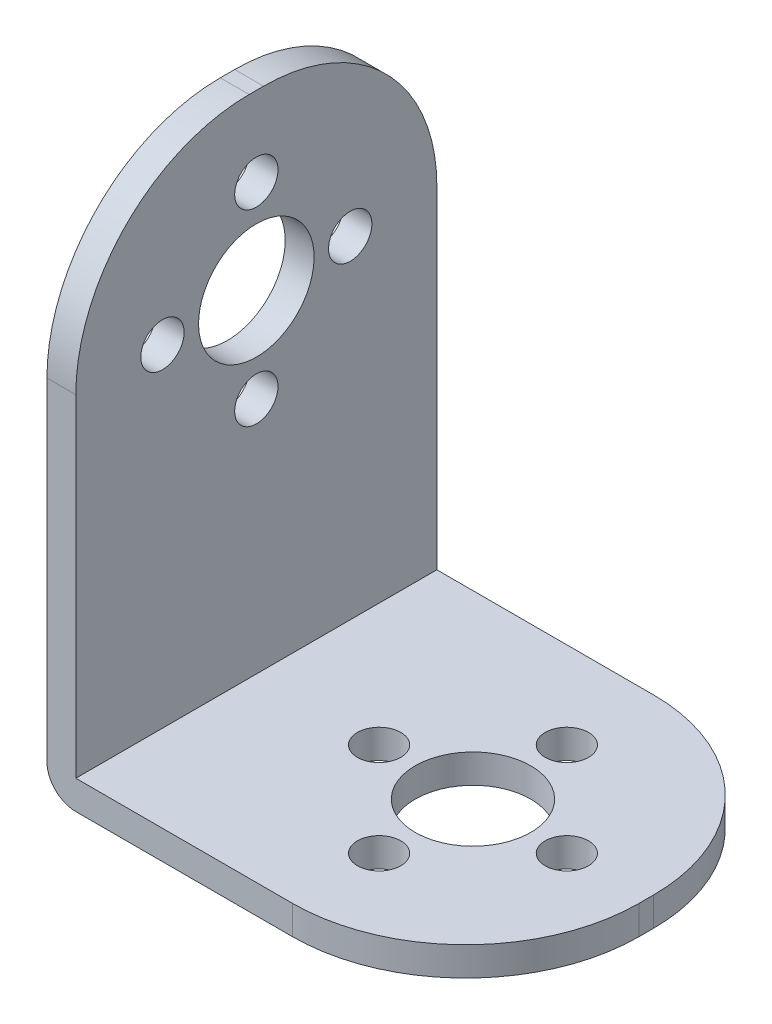
from build123d import *

# Parameters (mm, degrees)
SKETCH1_W           = 29
SKETCH1_H           = 25
BOSS_EXTRUDE1_DEPTH = 37
SKETCH2_W           = 27
SKETCH2_H           = 35
CUT_EXTRUDE1_DEPTH  = 37
FILLET1_R           = 2
SKETCH3_R           = 1.5
SKETCH3_R_2         = 4
CUT_EXTRUDE2_DEPTH  = 52.874849397
FILLET3_R           = 12
FILLET4_R           = 12
SKETCH5_R           = 1.5
SKETCH5_R_2         = 4
CUT_EXTRUDE3_DEPTH  = 53.182372503


with BuildPart() as part:
    # Sketch1 → Boss-Extrude1 (new body)
    with BuildSketch(Plane(origin=(0, 0, 0), x_dir=(1, 0, 0), z_dir=(0, 1, 0))):
        with Locations((14.5, 12.5)):
            Rectangle(SKETCH1_W, SKETCH1_H)
    extrude(amount=BOSS_EXTRUDE1_DEPTH)

    # Sketch2 → Cut-Extrude1 (cut)
    with BuildSketch(Plane.XY):
        with Locations((15.5, 19.5)):
            Rectangle(SKETCH2_W, SKETCH2_H)
    extrude(amount=-CUT_EXTRUDE1_DEPTH, mode=Mode.SUBTRACT)

    # Fillet1
    fillet1_edges = [part.edges().sort_by_distance(p)[0] for p in [
        (0, 0, -12.5),
    ]]
    fillet(fillet1_edges, radius=FILLET1_R)

    # Sketch3 → Cut-Extrude2 (cut, through all)
    with BuildSketch(Plane(origin=(0, 2, 0), x_dir=(1, 0, 0), z_dir=(0, 1, 0))):
        with Locations(Location((23.5, 12.5, 0), (0, 0, 180))):
            Circle(SKETCH3_R)
        with Locations(Location((17, 12.5, 0), (0, 0, 180))):
            Circle(SKETCH3_R_2)
        with Locations(Location((10.5, 12.5, 0), (0, 0, 180))):
            Circle(SKETCH3_R)
        with Locations(Location((17, 19, 0), (0, 0, 180))):
            Circle(SKETCH3_R)
        with Locations((17, 6)):
            Circle(SKETCH3_R)
    extrude(amount=-CUT_EXTRUDE2_DEPTH, mode=Mode.SUBTRACT)

    # Fillet3
    fillet3_edges = [part.edges().sort_by_distance(p)[0] for p in [
        (29, 1, -25),
        (29, 1, 0),
    ]]
    fillet(fillet3_edges, radius=FILLET3_R)

    # Fillet4
    fillet4_edges = [part.edges().sort_by_distance(p)[0] for p in [
        (1, 37, -25),
        (1, 37, 0),
    ]]
    fillet(fillet4_edges, radius=FILLET4_R)

    # Sketch5 → Cut-Extrude3 (cut, through all)
    with BuildSketch(Plane(origin=(2, 0, 0), x_dir=(0, 0, -1), z_dir=(1, 0, 0))):
        with Locations(Location((12.5, 31.5, 0), (0, 0, 90))):
            Circle(SKETCH5_R)
        with Locations(Location((12.5, 25, 0), (0, 0, 90))):
            Circle(SKETCH5_R_2)
        with Locations(Location((6, 25, 0), (0, 0, 90))):
            Circle(SKETCH5_R)
        with Locations(Location((19, 25, 0), (0, 0, 270))):
            Circle(SKETCH5_R)
        with Locations(Location((12.5, 18.5, 0), (0, 0, 90))):
            Circle(SKETCH5_R)
    extrude(amount=-CUT_EXTRUDE3_DEPTH, mode=Mode.SUBTRACT)


solid = part.part
